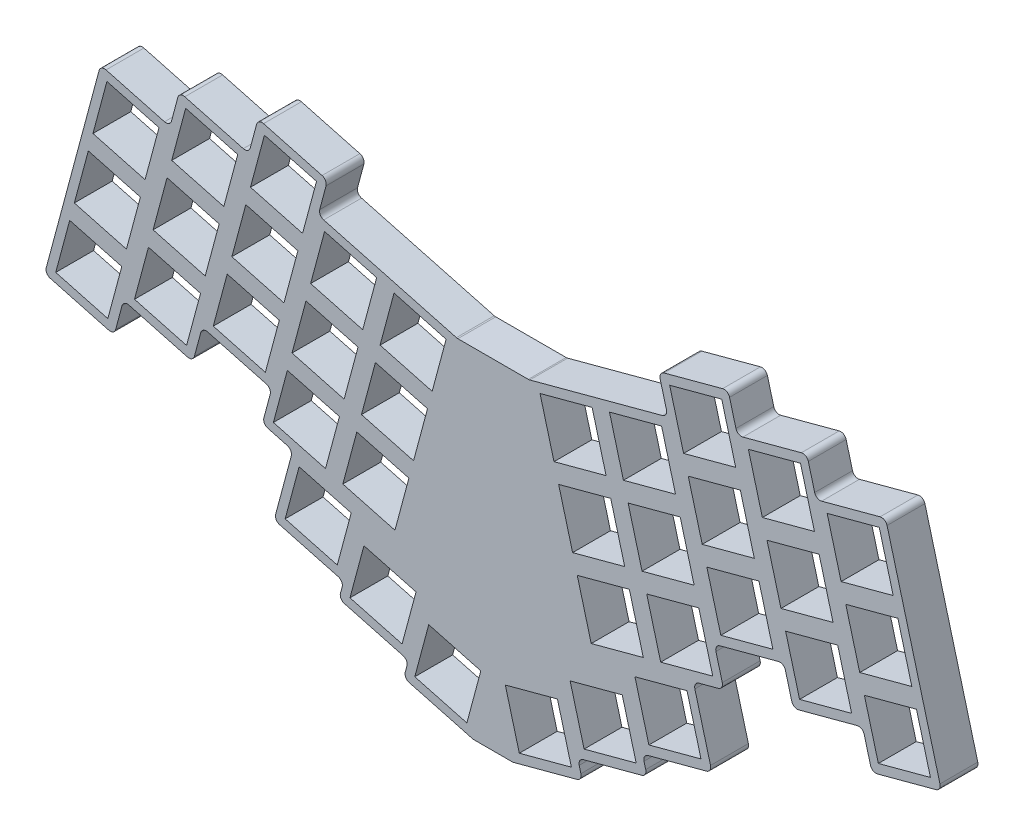
from build123d import *

# Parameters (mm, degrees)
BOSS_EXTRUDE1_DEPTH = 10


with BuildPart() as part:
    # Sketch2 → Boss-Extrude1 (new body)
    with BuildSketch(Plane.XY):
        with BuildLine():
            Line((9.302521254, 0), (-9.302521254, 0))
            ThreePointArc((-9.302521254, 0), (-9.498310542, 0.012832708), (-9.690749821, 0.051111261))
            Line((-9.690749821, 0.051111261), (-44.75629266, 9.446895146))
            ThreePointArc((-44.75629266, 9.446895146), (-45.667102198, 10.145783886), (-45.816952831, 11.284012453))
            Line((-45.816952831, 11.284012453), (-44.134629038, 17.562530324))
            ThreePointArc((-44.134629038, 17.562530324), (-44.284479672, 18.700758892), (-45.19528921, 19.399647631))
            Line((-45.19528921, 19.399647631), (-60.650102431, 23.540752353))
            ThreePointArc((-60.650102431, 23.540752353), (-61.788330998, 23.390901719), (-62.487219738, 22.480092181))
            Line((-62.487219738, 22.480092181), (-64.169543531, 16.20157431))
            ThreePointArc((-64.169543531, 16.20157431), (-64.86843227, 15.290764772), (-66.006660838, 15.140914138))
            Line((-66.006660838, 15.140914138), (-81.461474059, 19.28201886))
            ThreePointArc((-81.461474059, 19.28201886), (-82.599702626, 19.132168226), (-83.298591366, 18.221358688))
            Line((-83.298591366, 18.221358688), (-84.980915159, 11.942840817))
            ThreePointArc((-84.980915159, 11.942840817), (-85.679803898, 11.032031279), (-86.818032466, 10.882180646))
            Line((-86.818032466, 10.882180646), (-102.272845687, 15.023285367))
            ThreePointArc((-102.272845687, 15.023285367), (-103.411074254, 14.873434734), (-104.109962994, 13.962625196))
            Line((-104.109962994, 13.962625196), (-118.086191429, -38.197369424))
            ThreePointArc((-118.086191429, -38.197369424), (-117.936340795, -39.335597992), (-117.025531257, -40.034486731))
            Line((-117.025531257, -40.034486731), (-101.570718037, -44.175591453))
            ThreePointArc((-101.570718037, -44.175591453), (-100.432489469, -44.025740819), (-99.73360073, -43.114931281))
            Line((-99.73360073, -43.114931281), (-98.051276936, -36.83641341))
            ThreePointArc((-98.051276936, -36.83641341), (-97.352388197, -35.925603872), (-96.214159629, -35.775753238))
            Line((-96.214159629, -35.775753238), (-80.759346409, -39.91685796))
            ThreePointArc((-80.759346409, -39.91685796), (-79.621117841, -39.767007326), (-78.922229102, -38.856197788))
            Line((-78.922229102, -38.856197788), (-77.239905309, -32.577679917))
            ThreePointArc((-77.239905309, -32.577679917), (-76.541016569, -31.666870379), (-75.402788001, -31.517019746))
            Line((-75.402788001, -31.517019746), (-59.947974781, -35.658124467))
            ThreePointArc((-59.947974781, -35.658124467), (-59.037165243, -36.357013207), (-58.887314609, -37.495241774))
            Line((-58.887314609, -37.495241774), (-60.569638402, -43.773759645))
            ThreePointArc((-60.569638402, -43.773759645), (-60.419787768, -44.911988213), (-59.50897823, -45.610876952))
            Line((-59.50897823, -45.610876952), (-54.377497278, -46.985853129))
            ThreePointArc((-54.377497278, -46.985853129), (-53.46668774, -47.684741869), (-53.316837106, -48.822970436))
            Line((-53.316837106, -48.822970436), (-57.457941828, -64.277783657))
            ThreePointArc((-57.457941828, -64.277783657), (-57.308091194, -65.416012225), (-56.397281656, -66.114900964))
            Line((-56.397281656, -66.114900964), (-40.942468436, -70.256005686))
            ThreePointArc((-40.942468436, -70.256005686), (-40.031658898, -70.954894425), (-39.881808264, -72.093122993))
            Line((-39.881808264, -72.093122993), (-40.334741593, -73.783493189))
            ThreePointArc((-40.334741593, -73.783493189), (-40.184890959, -74.921721757), (-39.274081421, -75.620610496))
            Line((-39.274081421, -75.620610496), (-23.8192682, -79.761715218))
            ThreePointArc((-23.8192682, -79.761715218), (-22.908458662, -80.460603957), (-22.758608029, -81.598832525))
            Line((-22.758608029, -81.598832525), (-23.211541358, -83.289202721))
            ThreePointArc((-23.211541358, -83.289202721), (-23.061690724, -84.427431288), (-22.150881186, -85.126320028))
            Line((-22.150881186, -85.126320028), (-5.437929047, -89.604542057))
            ThreePointArc((-5.437929047, -89.604542057), (-5.245489768, -89.642820609), (-5.049700479, -89.655653317))
            Line((-5.049700479, -89.655653317), (5.049700479, -89.655653317))
            ThreePointArc((5.049700479, -89.655653317), (5.245489768, -89.642820609), (5.437929047, -89.604542057))
            Line((5.437929047, -89.604542057), (22.150881186, -85.126320028))
            ThreePointArc((22.150881186, -85.126320028), (23.061690724, -84.427431288), (23.211541358, -83.289202721))
            Line((23.211541358, -83.289202721), (22.758608029, -81.598832525))
            ThreePointArc((22.758608029, -81.598832525), (22.908458662, -80.460603957), (23.8192682, -79.761715218))
            Line((23.8192682, -79.761715218), (39.274081421, -75.620610496))
            ThreePointArc((39.274081421, -75.620610496), (40.184890959, -74.921721757), (40.334741593, -73.783493189))
            Line((40.334741593, -73.783493189), (39.881808264, -72.093122993))
            ThreePointArc((39.881808264, -72.093122993), (40.031658898, -70.954894425), (40.942468436, -70.256005686))
            Line((40.942468436, -70.256005686), (56.397281656, -66.114900964))
            ThreePointArc((56.397281656, -66.114900964), (57.308091194, -65.416012225), (57.457941828, -64.277783657))
            Line((57.457941828, -64.277783657), (53.316837106, -48.822970436))
            ThreePointArc((53.316837106, -48.822970436), (53.46668774, -47.684741869), (54.377497278, -46.985853129))
            Line((54.377497278, -46.985853129), (59.50897823, -45.610876952))
            ThreePointArc((59.50897823, -45.610876952), (60.419787768, -44.911988213), (60.569638402, -43.773759645))
            Line((60.569638402, -43.773759645), (58.887314609, -37.495241774))
            ThreePointArc((58.887314609, -37.495241774), (59.037165243, -36.357013207), (59.947974781, -35.658124467))
            Line((59.947974781, -35.658124467), (75.402788001, -31.517019746))
            ThreePointArc((75.402788001, -31.517019746), (76.541016569, -31.666870379), (77.239905309, -32.577679917))
            Line((77.239905309, -32.577679917), (78.922229102, -38.856197788))
            ThreePointArc((78.922229102, -38.856197788), (79.621117841, -39.767007326), (80.759346409, -39.91685796))
            Line((80.759346409, -39.91685796), (96.214159629, -35.775753238))
            ThreePointArc((96.214159629, -35.775753238), (97.352388197, -35.925603872), (98.051276936, -36.83641341))
            Line((98.051276936, -36.83641341), (99.73360073, -43.114931281))
            ThreePointArc((99.73360073, -43.114931281), (100.432489469, -44.025740819), (101.570718037, -44.175591453))
            Line((101.570718037, -44.175591453), (117.025531257, -40.034486731))
            ThreePointArc((117.025531257, -40.034486731), (117.936340795, -39.335597992), (118.086191429, -38.197369424))
            Line((118.086191429, -38.197369424), (104.109962994, 13.962625196))
            ThreePointArc((104.109962994, 13.962625196), (103.411074254, 14.873434734), (102.272845687, 15.023285367))
            Line((102.272845687, 15.023285367), (86.818032466, 10.882180646))
            ThreePointArc((86.818032466, 10.882180646), (85.679803898, 11.032031279), (84.980915159, 11.942840817))
            Line((84.980915159, 11.942840817), (83.298591366, 18.221358688))
            ThreePointArc((83.298591366, 18.221358688), (82.599702626, 19.132168226), (81.461474059, 19.28201886))
            Line((81.461474059, 19.28201886), (66.006660838, 15.140914138))
            ThreePointArc((66.006660838, 15.140914138), (64.86843227, 15.290764772), (64.169543531, 16.20157431))
            Line((64.169543531, 16.20157431), (62.487219738, 22.480092181))
            ThreePointArc((62.487219738, 22.480092181), (61.788330998, 23.390901719), (60.650102431, 23.540752353))
            Line((60.650102431, 23.540752353), (45.19528921, 19.399647631))
            ThreePointArc((45.19528921, 19.399647631), (44.284479672, 18.700758892), (44.134629038, 17.562530324))
            Line((44.134629038, 17.562530324), (45.816952831, 11.284012453))
            ThreePointArc((45.816952831, 11.284012453), (45.667102198, 10.145783886), (44.75629266, 9.446895146))
            Line((44.75629266, 9.446895146), (9.690749821, 0.051111261))
            ThreePointArc((9.690749821, 0.051111261), (9.498310542, 0.012832708), (9.302521254, 0))
        make_face()
        Polygon((-91.066107907, -19.943703041), (-94.754279299, -33.708146065), (-80.989836275, -37.396317458), (-77.301664882, -23.631874433), align=None, mode=Mode.SUBTRACT)
        Polygon((-81.230984193, 16.761478358), (-84.919155585, 2.997035334), (-71.154712561, -0.691136059), (-67.466541168, 13.073306966), align=None, mode=Mode.SUBTRACT)
        Polygon((-86.14854605, -1.591112341), (-89.836717442, -15.355555366), (-76.072274418, -19.043726759), (-72.384103025, -5.279283734), align=None, mode=Mode.SUBTRACT)
        Polygon((-65.337174422, 2.667621152), (-69.025345814, -11.096821873), (-55.26090279, -14.784993266), (-51.572731397, -1.020550241), align=None, mode=Mode.SUBTRACT)
        Polygon((-60.419612565, 21.020211851), (-64.107783957, 7.255768826), (-50.343340933, 3.567597434), (-46.65516954, 17.332040458), align=None, mode=Mode.SUBTRACT)
        Polygon((-70.254736279, -15.684969548), (-73.942907671, -29.449412573), (-60.178464647, -33.137583965), (-56.490293254, -19.373140941), align=None, mode=Mode.SUBTRACT)
        Polygon((-3.238386438, -72.982441223), (-17.002829463, -69.29426983), (-20.691000856, -83.058712855), (-6.926557831, -86.746884248), align=None, mode=Mode.SUBTRACT)
        Polygon((-20.361586674, -63.476731691), (-34.126029698, -59.788560298), (-37.814201091, -73.553003323), (-24.049758066, -77.241174716), align=None, mode=Mode.SUBTRACT)
        Polygon((-54.360926508, -29.778826755), (-58.0490979, -43.543269779), (-44.284654876, -47.231441172), (-40.596483483, -33.466998147), align=None, mode=Mode.SUBTRACT)
        Polygon((-31.090773951, -16.343797912), (-34.778945344, -30.108240937), (-21.014502319, -33.796412329), (-17.326330927, -20.031969305), align=None, mode=Mode.SUBTRACT)
        Polygon((-44.525802794, 6.926354644), (-48.213974186, -6.83808838), (-34.449531162, -10.526259773), (-30.761359769, 3.238183252), align=None, mode=Mode.SUBTRACT)
        Polygon((-51.249229933, -50.282850767), (-54.937401326, -64.047293791), (-41.172958302, -67.735465184), (-37.484786909, -53.971022159), align=None, mode=Mode.SUBTRACT)
        Polygon((-26.173212094, 2.008792787), (-29.861383487, -11.755650237), (-16.096940462, -15.44382163), (-12.40876907, -1.679378605), align=None, mode=Mode.SUBTRACT)
        Polygon((-49.443364651, -11.426236055), (-53.131536043, -25.19067908), (-39.367093019, -28.878850472), (-35.678921626, -15.114407448), align=None, mode=Mode.SUBTRACT)
        Polygon((-36.008335808, -34.696388612), (-39.696507201, -48.460831636), (-25.932064176, -52.149003029), (-22.243892783, -38.384560004), align=None, mode=Mode.SUBTRACT)
        Polygon((-105.730527213, -1.261698159), (-91.966084189, -4.949869552), (-88.277912796, 8.814573473), (-102.042355821, 12.502744865), align=None, mode=Mode.SUBTRACT)
        Polygon((-110.64808907, -19.614288859), (-96.883646046, -23.302460251), (-93.195474653, -9.538017227), (-106.959917678, -5.849845834), align=None, mode=Mode.SUBTRACT)
        Polygon((-115.565650927, -37.966879558), (-101.801207903, -41.655050951), (-98.11303651, -27.890607926), (-111.877479535, -24.202436534), align=None, mode=Mode.SUBTRACT)
        Polygon((94.754279299, -33.708146065), (91.066107907, -19.943703041), (77.301664882, -23.631874433), (80.989836275, -37.396317458), align=None, mode=Mode.SUBTRACT)
        Polygon((84.919155585, 2.997035334), (81.230984193, 16.761478358), (67.466541168, 13.073306966), (71.154712561, -0.691136059), align=None, mode=Mode.SUBTRACT)
        Polygon((89.836717442, -15.355555366), (86.14854605, -1.591112341), (72.384103025, -5.279283734), (76.072274418, -19.043726759), align=None, mode=Mode.SUBTRACT)
        Polygon((69.025345814, -11.096821873), (65.337174422, 2.667621152), (51.572731397, -1.020550241), (55.26090279, -14.784993266), align=None, mode=Mode.SUBTRACT)
        Polygon((64.107783957, 7.255768826), (60.419612565, 21.020211851), (46.65516954, 17.332040458), (50.343340933, 3.567597434), align=None, mode=Mode.SUBTRACT)
        Polygon((73.942907671, -29.449412573), (70.254736279, -15.684969548), (56.490293254, -19.373140941), (60.178464647, -33.137583965), align=None, mode=Mode.SUBTRACT)
        Polygon((17.002829463, -69.29426983), (3.238386438, -72.982441223), (6.926557831, -86.746884248), (20.691000856, -83.058712855), align=None, mode=Mode.SUBTRACT)
        Polygon((34.126029698, -59.788560298), (20.361586674, -63.476731691), (24.049758066, -77.241174716), (37.814201091, -73.553003323), align=None, mode=Mode.SUBTRACT)
        Polygon((58.0490979, -43.543269779), (54.360926508, -29.778826755), (40.596483483, -33.466998147), (44.284654876, -47.231441172), align=None, mode=Mode.SUBTRACT)
        Polygon((34.778945344, -30.108240937), (31.090773951, -16.343797912), (17.326330927, -20.031969305), (21.014502319, -33.796412329), align=None, mode=Mode.SUBTRACT)
        Polygon((48.213974186, -6.83808838), (44.525802794, 6.926354644), (30.761359769, 3.238183252), (34.449531162, -10.526259773), align=None, mode=Mode.SUBTRACT)
        Polygon((54.937401326, -64.047293791), (51.249229933, -50.282850767), (37.484786909, -53.971022159), (41.172958302, -67.735465184), align=None, mode=Mode.SUBTRACT)
        Polygon((29.861383487, -11.755650237), (26.173212094, 2.008792787), (12.40876907, -1.679378605), (16.096940462, -15.44382163), align=None, mode=Mode.SUBTRACT)
        Polygon((53.131536043, -25.19067908), (49.443364651, -11.426236055), (35.678921626, -15.114407448), (39.367093019, -28.878850472), align=None, mode=Mode.SUBTRACT)
        Polygon((39.696507201, -48.460831636), (36.008335808, -34.696388612), (22.243892783, -38.384560004), (25.932064176, -52.149003029), align=None, mode=Mode.SUBTRACT)
        Polygon((91.966084189, -4.949869552), (105.730527213, -1.261698159), (102.042355821, 12.502744865), (88.277912796, 8.814573473), align=None, mode=Mode.SUBTRACT)
        Polygon((96.883646046, -23.302460251), (110.64808907, -19.614288859), (106.959917678, -5.849845834), (93.195474653, -9.538017227), align=None, mode=Mode.SUBTRACT)
        Polygon((101.801207903, -41.655050951), (115.565650927, -37.966879558), (111.877479535, -24.202436534), (98.11303651, -27.890607926), align=None, mode=Mode.SUBTRACT)
    extrude(amount=BOSS_EXTRUDE1_DEPTH)


solid = part.part
